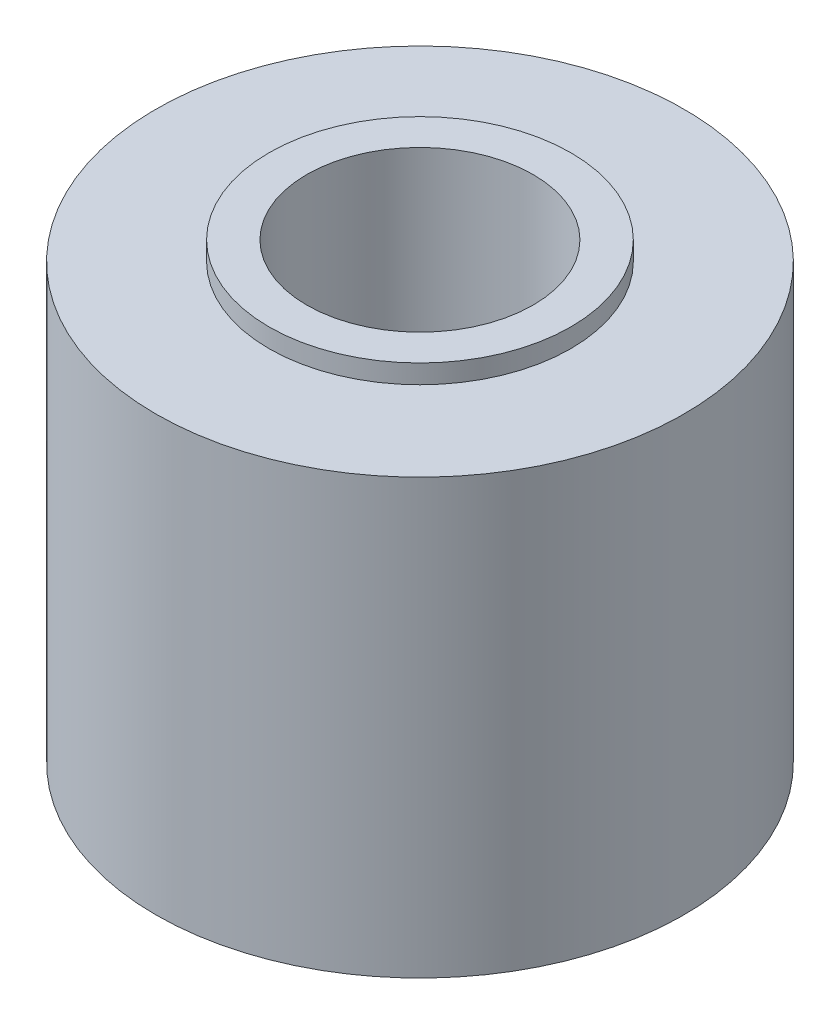
from build123d import *

# Parameters (mm, degrees)
SKETCH1_R           = 7
SKETCH1_R_2         = 3
BOSS_EXTRUDE1_DEPTH = 14
SKETCH2_W           = 3
SKETCH2_H           = 2
SKETCH2_H_2         = 0.5


with BuildPart() as part:
    # Sketch1 → Boss-Extrude1 (new body)
    with BuildSketch(Plane(origin=(0, 0, 0), x_dir=(1, 0, 0), z_dir=(0, 1, 0))):
        with Locations(Location((0, 0, 0), (0, 0, 270))):
            Circle(SKETCH1_R)
        with Locations(Location((0, 0, 0), (0, 0, 270))):
            Circle(SKETCH1_R_2, mode=Mode.SUBTRACT)
    extrude(amount=BOSS_EXTRUDE1_DEPTH)

    # Sketch2 → Cut-Revolve1 (revolve, cut)
    with BuildSketch(Plane.XY, mode=Mode.PRIVATE) as cut_revolve1_sk:
        with Locations((5.5, 1)):
            Rectangle(SKETCH2_W, SKETCH2_H)
        with Locations((5.5, 13.75)):
            Rectangle(SKETCH2_W, SKETCH2_H_2)
    revolve(cut_revolve1_sk.sketch.rotate(Axis((0, 14, 0), (0, -1, 0)), 90), axis=Axis((0, 14, 0), (0, -1, 0)), mode=Mode.SUBTRACT)


solid = part.part
